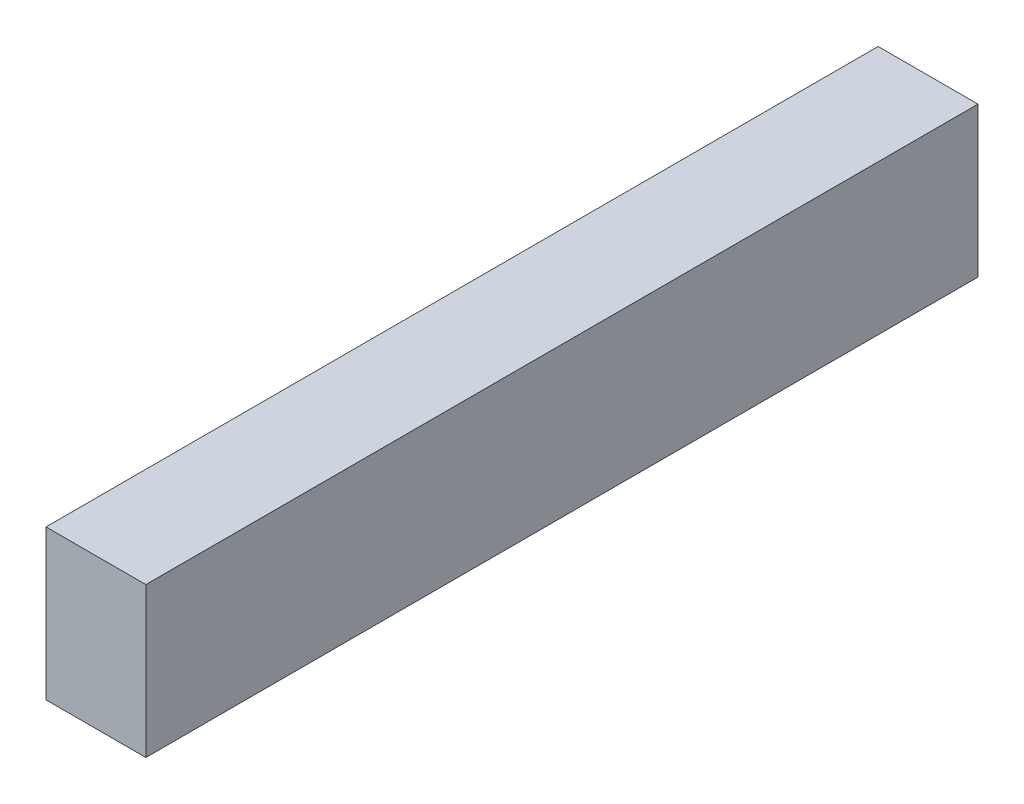
from build123d import *

# Parameters (mm, degrees)
SKETCH1_W      = 38.1
SKETCH1_H      = 57.15
EXTRUDE1_DEPTH = 317.5


with BuildPart() as part:
    # Sketch1 → Extrude1 (new body)
    with BuildSketch(Plane.XY):
        with Locations((0, -28.575)):
            Rectangle(SKETCH1_W, SKETCH1_H)
    extrude(amount=-EXTRUDE1_DEPTH)


solid = part.part
